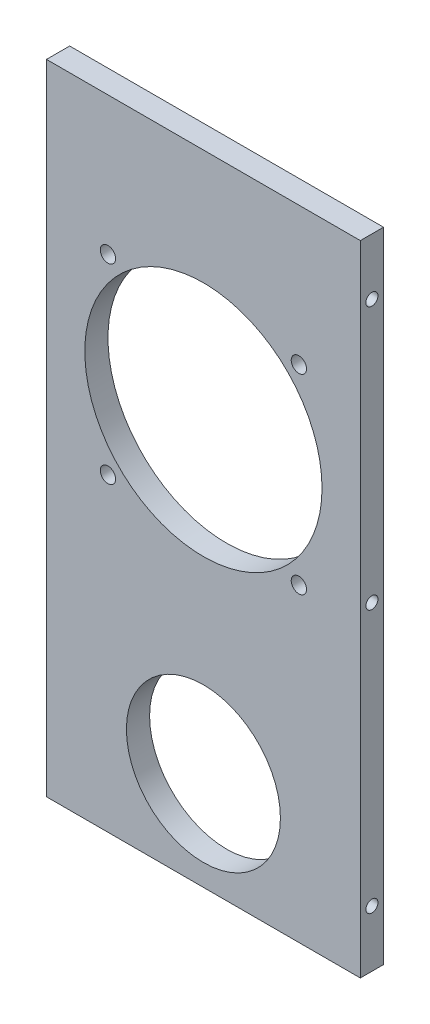
from build123d import *

# Parameters (mm, degrees)
SKETCH1_W           = 86
SKETCH1_H           = 175
BOSS_EXTRUDE1_DEPTH = 3.175
SKETCH3_R           = 1.65
CUT_EXTRUDE1_DEPTH  = 10
SKETCH4_R           = 32.5
CUT_EXTRUDE2_DEPTH  = 98.701445742
SKETCH4_3_R         = 2.1
CUT_EXTRUDE3_DEPTH  = 98.701445742
SKETCH7_R           = 21.1
CUT_EXTRUDE4_DEPTH  = 98.701445742


with BuildPart() as part:
    # Sketch1 → Boss-Extrude1 (new, symmetric)
    with BuildSketch(Plane.XY):
        Rectangle(SKETCH1_W, SKETCH1_H)
    extrude(amount=BOSS_EXTRUDE1_DEPTH, both=True)

    # Sketch3 → Cut-Extrude1 (cut)
    with BuildSketch(Plane.ZY.offset(43)):
        with Locations((0, 72)):
            Circle(SKETCH3_R)
        Circle(SKETCH3_R)
        with Locations((0, -72)):
            Circle(SKETCH3_R)
    cut_extrude1 = extrude(amount=-CUT_EXTRUDE1_DEPTH, mode=Mode.SUBTRACT)

    # Mirror1: Cut-Extrude1 across plane
    add(cut_extrude1.mirror(Plane(origin=(0, 0, 0), x_dir=(0, 0, 1), z_dir=(1, 0, 0))), mode=Mode.SUBTRACT)

    # Sketch4 → Cut-Extrude2 (cut, through all)
    with BuildSketch(Plane.XY.offset(3.175)):
        with Locations((0, 23.5)):
            Circle(SKETCH4_R)
    extrude(amount=-CUT_EXTRUDE2_DEPTH, mode=Mode.SUBTRACT)

    # Sketch4<3> → Cut-Extrude3 (cut, through all)
    with BuildSketch(Plane.XY.offset(3.175)):
        with Locations((-26.162950904, 49.662950904)):
            Circle(SKETCH4_3_R)
        with Locations((26.162950904, 49.662950904)):
            Circle(SKETCH4_3_R)
        with Locations((26.162950904, -2.662950904)):
            Circle(SKETCH4_3_R)
        with Locations((-26.162950904, -2.662950904)):
            Circle(SKETCH4_3_R)
    extrude(amount=-CUT_EXTRUDE3_DEPTH, mode=Mode.SUBTRACT)

    # Sketch7 → Cut-Extrude4 (cut, through all)
    with BuildSketch(Plane.XY.offset(3.175)):
        with Locations((0, -60.5)):
            Circle(SKETCH7_R)
    extrude(amount=-CUT_EXTRUDE4_DEPTH, mode=Mode.SUBTRACT)


solid = part.part
